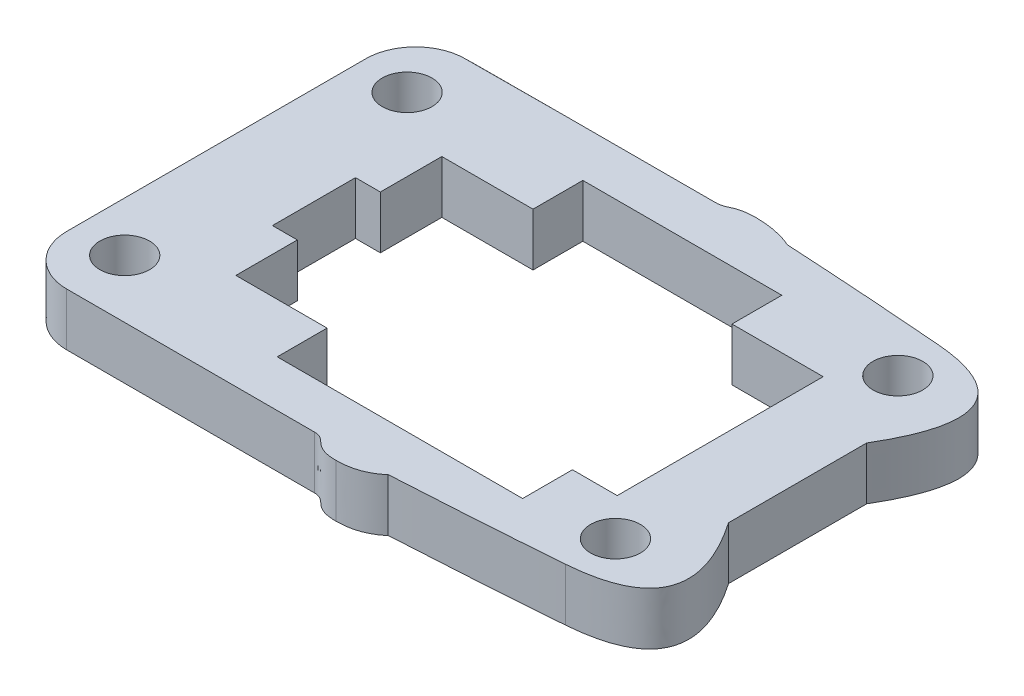
from build123d import *

# Parameters (mm, degrees)
SKETCH1_R           = 1.497356825
SKETCH1_R_2         = 1.497356824
BOSS_EXTRUDE1_DEPTH = 3.175


with BuildPart() as part:
    # Sketch1 → Boss-Extrude1 (new body)
    with BuildSketch(Plane(origin=(0, 0, 0), x_dir=(1, 0, 0), z_dir=(0, 1, 0))):
        with BuildLine():
            Line((-8.136635094, -21.924266481), (-8.136635094, -3.923663686))
            add(Edge.make_bspline(
                [(-8.136635094, -3.923663686), (-8.136635094, -3.128086205), (-7.820964416, -2.365025621), (-7.259379446, -1.802237676)],
                knots=[1, 1, 1, 1, 2, 2, 2, 2], degree=3))
            add(Edge.make_bspline(
                [(-7.259379446, -1.802237676), (-6.697735984, -1.239635291), (-5.936245423, -0.92358316), (-5.141916572, -0.92358316)],
                knots=[2, 2, 2, 2, 3, 3, 3, 3], degree=3))
            add(Edge.make_bspline(
                [(-5.141916572, -0.92358316), (-5.154760404, -0.903039747), (4.165830441, -0.878716777), (9.879205527, -0.887994762)],
                knots=[3, 3, 3, 3, 4, 4, 4, 4], degree=3))
            add(Edge.make_bspline(
                [(9.879205527, -0.887994762), (10.624976408, -0.889274148), (10.564154649, -0.451680408), (11.906649469, -0.451680408)],
                knots=[4, 4, 4, 4, 5, 5, 5, 5], degree=3))
            add(Edge.make_bspline(
                [(11.906649469, -0.451680408), (13.315966334, -0.451680408), (14.214756726, -0.909055789), (14.223632862, -0.923583161)],
                knots=[5, 5, 5, 5, 6, 6, 6, 6], degree=3))
            add(Edge.make_bspline(
                [(14.223632862, -0.923583161), (19.256657746, -1.206420105), (23.971643033, -1.588653571)],
                knots=[6, 6, 6, 7, 7, 7], degree=2))
            add(Edge.make_bspline(
                [(23.971643033, -1.588653571), (30.995498409, -2.158356056), (26.975559396, -8.867814209)],
                knots=[7, 7, 7, 8, 8, 8], degree=2))
            Line((26.975559396, -8.867814209), (26.975559396, -17.1873007))
            add(Edge.make_bspline(
                [(26.975559396, -17.1873007), (31.442656292, -23.689574114), (24.231731846, -24.259083715)],
                knots=[9, 9, 9, 10, 10, 10], degree=2))
            add(Edge.make_bspline(
                [(24.231731846, -24.259083715), (19.39082339, -24.641510065), (14.223632861, -24.924217604)],
                knots=[10, 10, 10, 11, 11, 11], degree=2))
            add(Edge.make_bspline(
                [(14.223632861, -24.924217604), (13.297697384, -25.752946792), (11.906649468, -25.752946792)],
                knots=[11, 11, 11, 12, 12, 12], degree=2))
            add(Edge.make_bspline(
                [(11.906649468, -25.752946792), (10.398617885, -25.752946792), (10.590032411, -24.924217604), (9.791165568, -24.924217604)],
                knots=[12, 12, 12, 12, 13, 13, 13, 13], degree=3))
            add(Edge.make_bspline(
                [(9.791165568, -24.924217604), (4.074534437, -24.924217604), (-5.141916573, -24.924217603)],
                knots=[13, 13, 13, 14, 14, 14], degree=2))
            add(Edge.make_bspline(
                [(-5.141916573, -24.924217603), (-5.936245424, -24.924217603), (-6.697735984, -24.608292434), (-7.259379446, -24.045694932)],
                knots=[14, 14, 14, 14, 15, 15, 15, 15], degree=3))
            add(Edge.make_bspline(
                [(-7.259379446, -24.045694932), (-7.820964416, -23.483094989), (-8.136635094, -22.71984152), (-8.136635094, -21.924266481)],
                knots=[15, 15, 15, 15, 16, 16, 16, 16], degree=3))
        make_face()
        with Locations(Location((-5.141916573, -4.423727567, 0), (0, 0, 270))):
            Circle(SKETCH1_R, mode=Mode.SUBTRACT)
        with Locations(Location((24.40576455, -4.423727568, 0), (0, 0, 270))):
            Circle(SKETCH1_R_2, mode=Mode.SUBTRACT)
        with Locations(Location((-5.141916573, -21.42420016, 0), (0, 0, 270))):
            Circle(SKETCH1_R_2, mode=Mode.SUBTRACT)
        with Locations(Location((24.40576455, -21.42420016, 0), (0, 0, 270))):
            Circle(SKETCH1_R_2, mode=Mode.SUBTRACT)
        Polygon((-2.246994867, -15.424170952), (-0.749638043, -15.424170952), (-0.749638043, -19.12426571), (4.740444467, -19.12426571), (4.740444467, -22.124153352), (19.514384952, -22.124153352), (19.514384952, -19.12426571), (22.209527799, -19.12426571), (22.209527799, -6.723857342), (16.719255189, -6.723857342), (16.719255189, -3.723713335), (4.740444467, -3.723713335), (4.740444467, -6.723857342), (-0.749638043, -6.723857342), (-0.749638043, -10.4239521), (-2.246994867, -10.4239521), align=None, mode=Mode.SUBTRACT)
    extrude(amount=BOSS_EXTRUDE1_DEPTH)


solid = part.part
